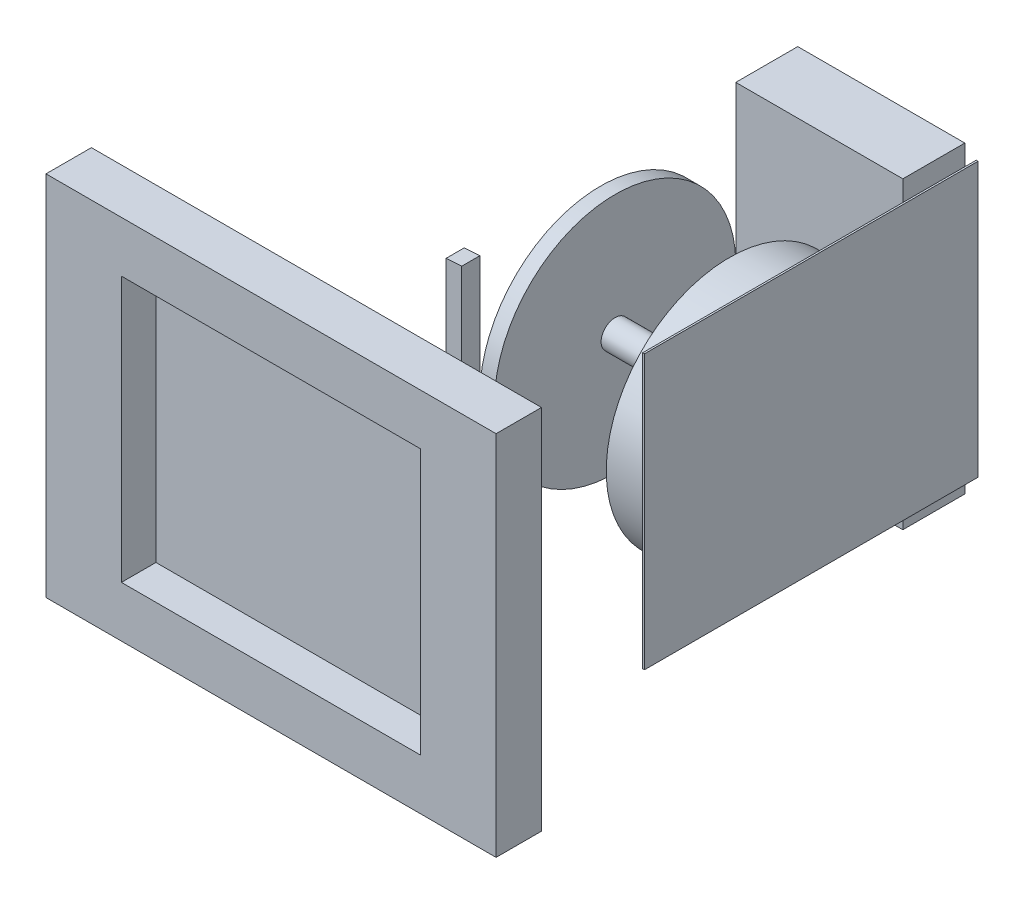
from build123d import *

# Parameters (mm, degrees)
SKETCH_1_R          = 66.463309376
EXTRUDE_1_DEPTH     = 5
SKETCH_2_R          = 4.530431435
SKETCH_2_R_2        = 3.906458017
SKETCH_2_R_3        = 5.41405512
SKETCH_2_R_4        = 4
SKETCH_2_R_5        = 4.19991494
SKETCH_2_R_6        = 4.312561176
CUT_EXTRUDE_1_DEPTH = 10
EXTRUDE_START       = 24
SKETCH_3_R          = 7.713116523
SKETCH_3_R_2        = 5.41405512
EXTRUDE_3_DEPTH     = 24
SKETCH_4_R          = 6.601098732
EXTRUDE_4_DEPTH     = 24
SKETCH_5_R          = 5.351234358
EXTRUDE_5_DEPTH     = 24
SKETCH_6_R          = 3.907915484
EXTRUDE_6_DEPTH     = 24
SKETCH_7_R          = 5.41405512
EXTRUDE_7_DEPTH     = 29
EXTRUDE_8_DEPTH     = 10
SKETCH_9_R          = 8.610253491
EXTRUDE_9_DEPTH     = 80
SKETCH_13_R         = 66.463309376
SKETCH_13_R_2       = 7.713116523
EXTRUDE_11_DEPTH    = 3
SKETCH_15_R         = 67.881895699
SKETCH_15_R_2       = 66.463309376
EXTRUDE_12_DEPTH    = 30
SKETCH_16_W         = 153.67843363
SKETCH_16_H         = 150.7028163
EXTRUDE_13_DEPTH    = 1
EXTRUDE_14_DEPTH    = 92
SKETCH_22_W         = 1
SKETCH_22_H         = 150.7028163
EXTRUDE_17_DEPTH    = 30
EXTRUDE_18_DEPTH    = 2
SKETCH_24_W         = 34.127146907
SKETCH_24_H         = 5.35954176
EXTRUDE_19_DEPTH    = 114
SKETCH_25_W         = 247.833477508
SKETCH_25_H         = 202.077094494
EXTRUDE_20_DEPTH    = 25
SKETCH_26_W         = 164.759802004
SKETCH_26_H         = 146.060069876
CUT_EXTRUDE_3_DEPTH = 19


with BuildPart() as part:
    # 草图1 → 凸台-拉伸1 (new body)
    with BuildSketch(Plane(origin=(0, 0, 0), x_dir=(0, 0, -1), z_dir=(1, 0, 0))):
        Circle(SKETCH_1_R)
    extrude(amount=EXTRUDE_1_DEPTH)

    # 草图2 → 切除-拉伸1 (cut)
    with BuildSketch(Plane(origin=(5, 0, 0), x_dir=(0, 0, -1), z_dir=(1, 0, 0))):
        with Locations((0, 36)):
            Circle(SKETCH_2_R)
        with Locations((0, 15)):
            Circle(SKETCH_2_R_2)
        Circle(SKETCH_2_R_3)
        with Locations((0, 58.592619022)):
            Circle(SKETCH_2_R_4)
        with Locations((14.571391813, 56.751824151)):
            Circle(SKETCH_2_R_4)
        with Locations((28.227209489, 51.345103451)):
            Circle(SKETCH_2_R_4)
        with Locations((40.109407781, 42.712181066)):
            Circle(SKETCH_2_R_4)
        with Locations((49.471384469, 31.39549526)):
            Circle(SKETCH_2_R_4)
        with Locations((55.724892128, 18.106115023)):
            Circle(SKETCH_2_R_4)
        with Locations((58.476999873, 3.679060989)):
            Circle(SKETCH_2_R_4)
        with Locations((57.554782652, -10.979161977)):
            Circle(SKETCH_2_R_4)
        with Locations((53.016186766, -24.947523818)):
            Circle(SKETCH_2_R_4)
        with Locations((45.146388886, -37.348340987)):
            Circle(SKETCH_2_R_4)
        with Locations((34.439877355, -47.402424534)):
            Circle(SKETCH_2_R_4)
        with Locations((21.569381668, -54.478039414)):
            Circle(SKETCH_2_R_4)
        with Locations((7.343602405, -58.130598721)):
            Circle(SKETCH_2_R_4)
        with Locations((-7.343602405, -58.130598721)):
            Circle(SKETCH_2_R_4)
        with Locations((-21.569381668, -54.478039414)):
            Circle(SKETCH_2_R_4)
        with Locations((-34.439877355, -47.402424534)):
            Circle(SKETCH_2_R_4)
        with Locations((-45.146388886, -37.348340987)):
            Circle(SKETCH_2_R_4)
        with Locations((-53.016186766, -24.947523818)):
            Circle(SKETCH_2_R_4)
        with Locations((-57.554782652, -10.979161977)):
            Circle(SKETCH_2_R_4)
        with Locations((-58.476999873, 3.679060989)):
            Circle(SKETCH_2_R_4)
        with Locations((-55.724892128, 18.106115023)):
            Circle(SKETCH_2_R_4)
        with Locations((-49.471384469, 31.39549526)):
            Circle(SKETCH_2_R_4)
        with Locations((-40.109407781, 42.712181066)):
            Circle(SKETCH_2_R_4)
        with Locations((-28.227209489, 51.345103451)):
            Circle(SKETCH_2_R_4)
        with Locations((-14.571391813, 56.751824151)):
            Circle(SKETCH_2_R_4)
        with Locations((0, 48)):
            Circle(SKETCH_2_R_5)
        with Locations((14.83281573, 45.650712782)):
            Circle(SKETCH_2_R_5)
        with Locations((28.21369211, 38.83281573)):
            Circle(SKETCH_2_R_5)
        with Locations((38.83281573, 28.21369211)):
            Circle(SKETCH_2_R_5)
        with Locations((45.650712782, 14.83281573)):
            Circle(SKETCH_2_R_5)
        with Locations((48, 0)):
            Circle(SKETCH_2_R_5)
        with Locations((45.650712782, -14.83281573)):
            Circle(SKETCH_2_R_5)
        with Locations((38.83281573, -28.21369211)):
            Circle(SKETCH_2_R_5)
        with Locations((28.21369211, -38.83281573)):
            Circle(SKETCH_2_R_5)
        with Locations((14.83281573, -45.650712782)):
            Circle(SKETCH_2_R_5)
        with Locations((0, -48)):
            Circle(SKETCH_2_R_5)
        with Locations((-14.83281573, -45.650712782)):
            Circle(SKETCH_2_R_5)
        with Locations((-28.21369211, -38.83281573)):
            Circle(SKETCH_2_R_5)
        with Locations((-38.83281573, -28.21369211)):
            Circle(SKETCH_2_R_5)
        with Locations((-45.650712782, -14.83281573)):
            Circle(SKETCH_2_R_5)
        with Locations((-48, 0)):
            Circle(SKETCH_2_R_5)
        with Locations((-45.650712782, 14.83281573)):
            Circle(SKETCH_2_R_5)
        with Locations((-38.83281573, 28.21369211)):
            Circle(SKETCH_2_R_5)
        with Locations((-28.21369211, 38.83281573)):
            Circle(SKETCH_2_R_5)
        with Locations((-14.83281573, 45.650712782)):
            Circle(SKETCH_2_R_5)
        with Locations((12.31272516, 33.828934348)):
            Circle(SKETCH_2_R)
        with Locations((23.140353949, 27.577599952)):
            Circle(SKETCH_2_R)
        with Locations((31.176914536, 18)):
            Circle(SKETCH_2_R)
        with Locations((35.453079108, 6.251334396)):
            Circle(SKETCH_2_R)
        with Locations((35.453079108, -6.251334396)):
            Circle(SKETCH_2_R)
        with Locations((31.176914536, -18)):
            Circle(SKETCH_2_R)
        with Locations((23.140353949, -27.577599952)):
            Circle(SKETCH_2_R)
        with Locations((12.31272516, -33.828934348)):
            Circle(SKETCH_2_R)
        with Locations((0, -36)):
            Circle(SKETCH_2_R)
        with Locations((-12.31272516, -33.828934348)):
            Circle(SKETCH_2_R)
        with Locations((-23.140353949, -27.577599952)):
            Circle(SKETCH_2_R)
        with Locations((-31.176914536, -18)):
            Circle(SKETCH_2_R)
        with Locations((-35.453079108, -6.251334396)):
            Circle(SKETCH_2_R)
        with Locations((-35.453079108, 6.251334396)):
            Circle(SKETCH_2_R)
        with Locations((-31.176914536, 18)):
            Circle(SKETCH_2_R)
        with Locations((-23.140353949, 27.577599952)):
            Circle(SKETCH_2_R)
        with Locations((-12.31272516, 33.828934348)):
            Circle(SKETCH_2_R)
        with Locations((0, 25)):
            Circle(SKETCH_2_R_6)
        with Locations((12.5, 21.650635095)):
            Circle(SKETCH_2_R_6)
        with Locations((21.650635095, 12.5)):
            Circle(SKETCH_2_R_6)
        with Locations((25, 0)):
            Circle(SKETCH_2_R_6)
        with Locations((21.650635095, -12.5)):
            Circle(SKETCH_2_R_6)
        with Locations((12.5, -21.650635095)):
            Circle(SKETCH_2_R_6)
        with Locations((0, -25)):
            Circle(SKETCH_2_R_6)
        with Locations((-12.5, -21.650635095)):
            Circle(SKETCH_2_R_6)
        with Locations((-21.650635095, -12.5)):
            Circle(SKETCH_2_R_6)
        with Locations((-25, 0)):
            Circle(SKETCH_2_R_6)
        with Locations((-21.650635095, 12.5)):
            Circle(SKETCH_2_R_6)
        with Locations((-12.5, 21.650635095)):
            Circle(SKETCH_2_R_6)
        with Locations((10.606601718, 10.606601718)):
            Circle(SKETCH_2_R_2)
        with Locations((15, 0)):
            Circle(SKETCH_2_R_2)
        with Locations((10.606601718, -10.606601718)):
            Circle(SKETCH_2_R_2)
        with Locations((0, -15)):
            Circle(SKETCH_2_R_2)
        with Locations((-10.606601718, -10.606601718)):
            Circle(SKETCH_2_R_2)
        with Locations((-15, 0)):
            Circle(SKETCH_2_R_2)
        with Locations((-10.606601718, 10.606601718)):
            Circle(SKETCH_2_R_2)
    extrude(amount=-CUT_EXTRUDE_1_DEPTH, mode=Mode.SUBTRACT)

    # 草图3 → 凸台-拉伸3 (add)
    with BuildSketch(Plane(origin=(5, 0, 0), x_dir=(0, 0, -1), z_dir=(1, 0, 0)).offset(EXTRUDE_START)):
        Circle(SKETCH_3_R)
        Circle(SKETCH_3_R_2, mode=Mode.SUBTRACT)
    extrude(amount=-EXTRUDE_3_DEPTH)

    # 草图4 → 凸台-拉伸4 (add)
    with BuildSketch(Plane(origin=(29, 0, 0), x_dir=(0, 0, -1), z_dir=(1, 0, 0))):
        Circle(SKETCH_4_R)
    extrude(amount=EXTRUDE_4_DEPTH)

    # 草图5 → 凸台-拉伸5 (add)
    with BuildSketch(Plane(origin=(53, 0, 0), x_dir=(0, 0, -1), z_dir=(1, 0, 0))):
        Circle(SKETCH_5_R)
    extrude(amount=EXTRUDE_5_DEPTH)

    # 草图6 → 凸台-拉伸6 (add)
    with BuildSketch(Plane(origin=(77, 0, 0), x_dir=(0, 0, -1), z_dir=(1, 0, 0))):
        Circle(SKETCH_6_R)
    extrude(amount=EXTRUDE_6_DEPTH)

    # 草图7 → 凸台-拉伸7 (add)
    with BuildSketch(Plane.ZY.offset(-29)):
        Circle(SKETCH_7_R)
    extrude(amount=EXTRUDE_7_DEPTH)

    # 草图13 → 凸台-拉伸11 (add)
    with BuildSketch(Plane(origin=(5, 0, 0), x_dir=(0, 0, -1), z_dir=(1, 0, 0))):
        Circle(SKETCH_13_R)
        Circle(SKETCH_13_R_2, mode=Mode.SUBTRACT)
    extrude(amount=EXTRUDE_11_DEPTH)



with BuildPart() as body_2:
    # 草图8 → 凸台-拉伸8 (new body)
    with BuildSketch(Plane.XY.offset(66.463309376)):
        Polygon((0, -66.463309376), (0, 66.463309376), (-8.610253491, 65.903224717), (-8.610253491, -65.903224717), align=None)
    extrude(amount=EXTRUDE_8_DEPTH)

    # 草图9 → 凸台-拉伸9 (add)
    with BuildSketch(Plane.XY.offset(76.463309376)):
        with Locations(Location((0, 0, 0), (0, 0, 180))):
            Circle(SKETCH_9_R)
    extrude(amount=EXTRUDE_9_DEPTH)

    # 草图25 → 凸台-拉伸20 (add)
    with BuildSketch(Plane.XY.offset(156.463309376)):
        Rectangle(SKETCH_25_W, SKETCH_25_H)
    extrude(amount=EXTRUDE_20_DEPTH)

    # 草图26 → 切除-拉伸3 (cut)
    with BuildSketch(Plane.XY.offset(181.463309376)):
        Rectangle(SKETCH_26_W, SKETCH_26_H)
    extrude(amount=-CUT_EXTRUDE_3_DEPTH, mode=Mode.SUBTRACT)


with BuildPart() as body_3:
    # 草图15 → 凸台-拉伸12 (new body)
    with BuildSketch(Plane(origin=(101, 0, 0), x_dir=(0, 0, -1), z_dir=(1, 0, 0))):
        Circle(SKETCH_15_R)
        Circle(SKETCH_15_R_2, mode=Mode.SUBTRACT)
    extrude(amount=-EXTRUDE_12_DEPTH)


with BuildPart() as part_1:
    add(part.part)

    add(body_3.part)  # 凸台-拉伸13 merges body 3
    # 草图16 → 凸台-拉伸13 (add)
    with BuildSketch(Plane(origin=(101, 0, 0), x_dir=(0, 0, -1), z_dir=(1, 0, 0))):
        Rectangle(SKETCH_16_W, SKETCH_16_H)
    extrude(amount=-EXTRUDE_13_DEPTH)



with BuildPart() as body_3_2:
    # 草图20 → 凸台-拉伸14 (new body)
    with BuildSketch(Plane(origin=(8, 0, 0), x_dir=(0, 0, -1), z_dir=(1, 0, 0))):
        Polygon((100.583837531, 86.661760611), (66.456690624, 86.661760611), (66.456690624, 66.463309376), (97.908426929, 66.463309376), (97.908426929, -66.463309376), (66.456690624, -66.463309376), (66.456690624, -80.71094991), (100.583837531, -80.71094991), align=None)
    extrude(amount=EXTRUDE_14_DEPTH)


with BuildPart() as part_2:
    add(part_1.part)

    add(body_3_2.part)  # 凸台-拉伸17 merges body 3 2
    # 草图22 → 凸台-拉伸17 (add)
    with BuildSketch(Plane(origin=(0, 0, -76.839216815), x_dir=(-1, 0, 0), z_dir=(0, 0, -1))):
        with Locations((-100.5, 0)):
            Rectangle(SKETCH_22_W, SKETCH_22_H)
    extrude(amount=EXTRUDE_17_DEPTH)

    # 草图23 → 凸台-拉伸18 (add)
    with BuildSketch(Plane.XY.offset(-66.456690624)):
        Polygon((8, 66.463309376), (8, -66.463309376), (100, -67.881895699), (100, 67.881895699), align=None)
    extrude(amount=-EXTRUDE_18_DEPTH)

    # 草图24 → 凸台-拉伸19 (add)
    with BuildSketch(Plane.ZY.offset(-8)):
        with Locations((-83.520264078, -78.03117903)):
            Rectangle(SKETCH_24_W, SKETCH_24_H)
    extrude(amount=EXTRUDE_19_DEPTH)


solid = Compound([body_2.part, part_2.part])
